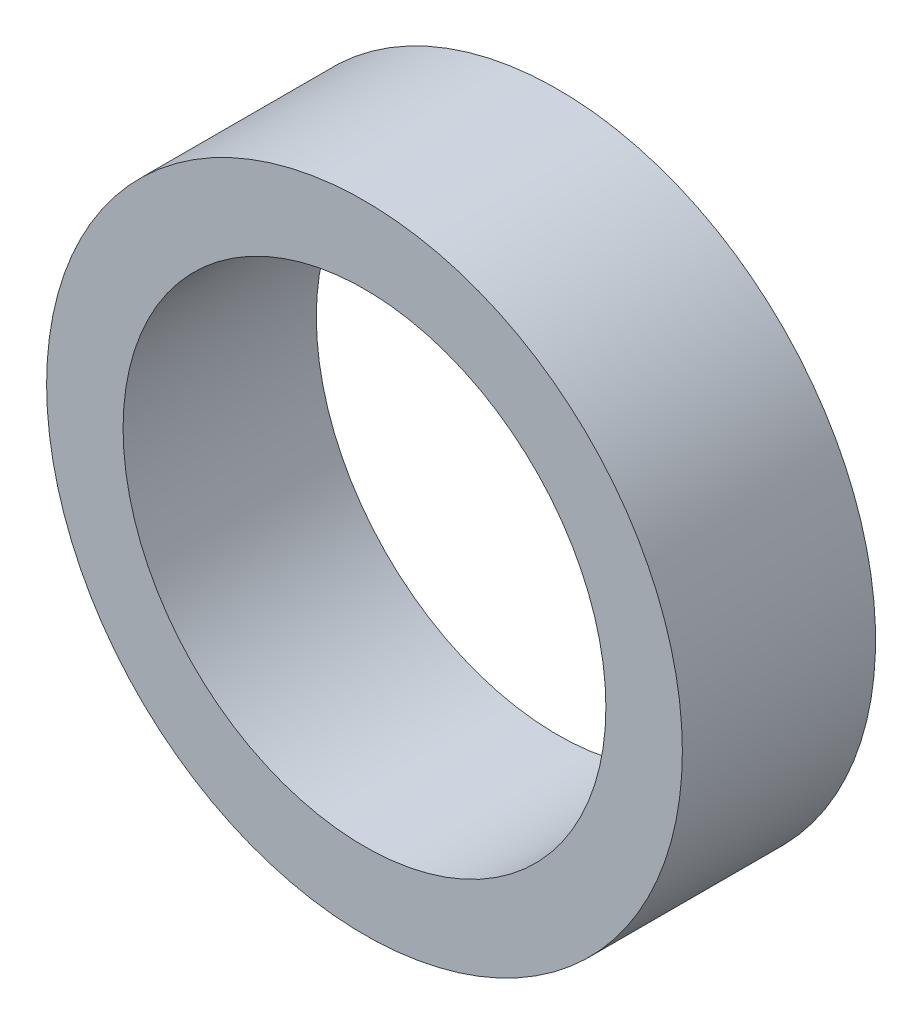
from build123d import *

# Parameters (mm, degrees)
SKETCH2_R           = 8.21
SKETCH2_R_2         = 6.235
BOSS_EXTRUDE1_DEPTH = 6.99
CUT_EXTRUDE3_START  = -2
SKETCH3_R           = 8.21
SKETCH3_R_2         = 6.235
CUT_EXTRUDE3_DEPTH  = 2
BOSS_EXTRUDE2_START = 2
SKETCH4_R           = 8.21
SKETCH4_R_2         = 6.235
BOSS_EXTRUDE2_DEPTH = 2
SKETCH7_R           = 8.21
SKETCH7_R_2         = 6.235
CUT_EXTRUDE4_DEPTH  = 2


with BuildPart() as part:
    # Sketch2 → Boss-Extrude1 (new body)
    with BuildSketch(Plane.XY):
        Circle(SKETCH2_R)
        Circle(SKETCH2_R_2, mode=Mode.SUBTRACT)
    extrude(amount=BOSS_EXTRUDE1_DEPTH)

    # Sketch3 → Cut-Extrude3 (cut)
    with BuildSketch(Plane.XY.offset(6.99).offset(CUT_EXTRUDE3_START)):
        Circle(SKETCH3_R)
        Circle(SKETCH3_R_2, mode=Mode.SUBTRACT)
    extrude(amount=CUT_EXTRUDE3_DEPTH, mode=Mode.SUBTRACT)

    # Sketch4 → Boss-Extrude2 (add)
    with BuildSketch(Plane(origin=(0, 0, 0), x_dir=(-1, 0, 0), z_dir=(0, 0, -1)).offset(BOSS_EXTRUDE2_START)):
        Circle(SKETCH4_R)
        Circle(SKETCH4_R_2, mode=Mode.SUBTRACT)
    extrude(amount=-BOSS_EXTRUDE2_DEPTH)

    # Sketch7 → Cut-Extrude4 (cut)
    with BuildSketch(Plane(origin=(0, 0, -2), x_dir=(-1, 0, 0), z_dir=(0, 0, -1))):
        Circle(SKETCH7_R)
        Circle(SKETCH7_R_2, mode=Mode.SUBTRACT)
    extrude(amount=-CUT_EXTRUDE4_DEPTH, mode=Mode.SUBTRACT)


solid = part.part
